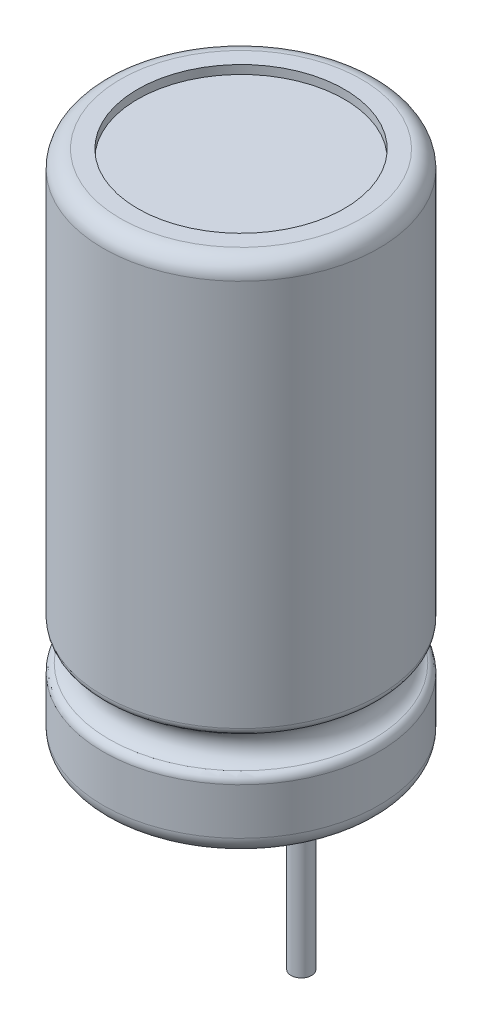
from build123d import *

# Parameters (mm, degrees)
SKETCH1_R           = 4
BASE_EXTRUDE_DEPTH  = 15
FILLET1_R           = 0.5
FILLET2_R           = 0.25
SKETCH4_R           = 3
CUT_EXTRUDE1_DEPTH  = 0.25
SKETCH3_R           = 0.3
BOSS_EXTRUDE1_DEPTH = 5
CUT_EXTRUDE2_START  = -3
SKETCH5_R           = 0.3
CUT_EXTRUDE2_DEPTH  = 3
CUT_EXTRUDE3_START  = -0.25
SKETCH6_R           = 3
CUT_EXTRUDE3_DEPTH  = 0.25


with BuildPart() as part:
    # Sketch1 → Base-Extrude (new body)
    with BuildSketch(Plane(origin=(0, 0, 0), x_dir=(1, 0, 0), z_dir=(0, 1, 0))):
        with Locations(Location((0, 0, 0), (0, 0, 270))):
            Circle(SKETCH1_R)
    extrude(amount=BASE_EXTRUDE_DEPTH)

    # Sketch2 → Cut-Revolve1 (revolve, cut)
    with BuildSketch(Plane(origin=(0, 0, 0), x_dir=(0, 0, -1), z_dir=(1, 0, 0)), mode=Mode.PRIVATE) as cut_revolve1_sk:
        with BuildLine():
            Line((-4, 3.053185949), (-4, 2.053185949))
            ThreePointArc((-4, 2.053185949), (-3.5, 2.553185949), (-4, 3.053185949))
        make_face()
    revolve(cut_revolve1_sk.sketch.rotate(Axis((0, 0, 0), (0, 1, 0)), 180), axis=Axis((0, 0, 0), (0, 1, 0)), mode=Mode.SUBTRACT)

    # Fillet1
    fillet1_edges = [part.edges().sort_by_distance(p)[0] for p in [
        (0, 0, -4),
        (0, 15, -4),
    ]]
    fillet(fillet1_edges, radius=FILLET1_R)

    # Fillet2
    fillet2_edges = [part.edges().sort_by_distance(p)[0] for p in [
        (-4, 2.053185949, 0),
        (-4, 3.053185949, 0),
    ]]
    fillet(fillet2_edges, radius=FILLET2_R)

    # Sketch4 → Cut-Extrude1 (cut)
    with BuildSketch(Plane.XZ):
        with Locations(Location((0, 0, 0), (0, 0, 270))):
            Circle(SKETCH4_R)
    extrude(amount=-CUT_EXTRUDE1_DEPTH, mode=Mode.SUBTRACT)

    # Sketch3 → Boss-Extrude1 (add)
    with BuildSketch(Plane.XZ.offset(-0.25)):
        with Locations(Location((-1.75, 0, 0), (0, 0, 270))):
            Circle(SKETCH3_R)
        with Locations(Location((1.75, 0, 0), (0, 0, 270))):
            Circle(SKETCH3_R)
    extrude(amount=BOSS_EXTRUDE1_DEPTH)

    # Sketch5 → Cut-Extrude2 (cut)
    with BuildSketch(Plane.XZ.offset(4.75).offset(CUT_EXTRUDE2_START)):
        with Locations(Location((-1.75, 0, 0), (0, 0, 270))):
            Circle(SKETCH5_R)
    extrude(amount=CUT_EXTRUDE2_DEPTH, mode=Mode.SUBTRACT)

    # Sketch6 → Cut-Extrude3 (cut)
    with BuildSketch(Plane(origin=(0, 15, 0), x_dir=(-1, 0, 0), z_dir=(0, 1, 0)).offset(CUT_EXTRUDE3_START)):
        with Locations(Location((0, 0, 0), (0, 0, 270))):
            Circle(SKETCH6_R)
    extrude(amount=CUT_EXTRUDE3_DEPTH, mode=Mode.SUBTRACT)


solid = part.part
